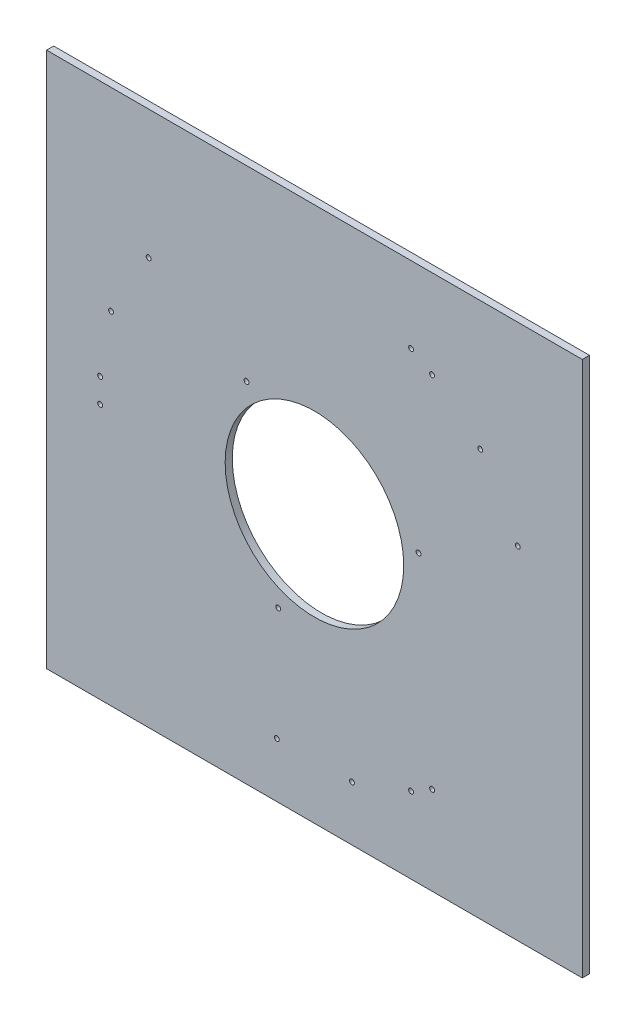
from build123d import *

# Parameters (mm, degrees)
SCHIZZO1_W                   = 375
SCHIZZO1_H                   = 375
ESTRUSIONE_ESTRUSIONE1_DEPTH = 5
TAGLIO_ESTRUSIONE1_REACH     = 267.212
SCHIZZO2_R                   = 62.5
FORO_PER_VITE_M3_4_D         = 3.4
RIPETIZIONECIRCOLARE1_COUNT  = 3
FORO_PER_VITE_M3_2_D         = 3.4
RIPETIZIONECIRCOLARE3_COUNT  = 3
FORO_PER_VITE_M3_5_D         = 3.4
RIPETIZIONECIRCOLARE4_COUNT  = 3


with BuildPart() as part:
    # Schizzo1 → Estrusione-Estrusione1 (new body)
    with BuildSketch(Plane.XY):
        Rectangle(SCHIZZO1_W, SCHIZZO1_H)
    extrude(amount=ESTRUSIONE_ESTRUSIONE1_DEPTH)

    # Schizzo2 → Taglio-Estrusione1 (cut, up to next)
    with BuildSketch(Plane.XY.offset(5), mode=Mode.PRIVATE) as taglio_estrusione1_sk1:
        Circle(SCHIZZO2_R)
    taglio_estrusione1_tool1 = extrude(taglio_estrusione1_sk1.sketch, amount=-TAGLIO_ESTRUSIONE1_REACH, mode=Mode.PRIVATE) & part.part
    add(taglio_estrusione1_tool1.solids().sort_by_distance((0, 0, 5))[0], mode=Mode.SUBTRACT)

    # Foro per Vite M3-4 (through all)
    with Locations(Plane.XY.offset(5)):
        with Locations((-26.307698917, -149.198374581), (26.307698917, -149.198374581)):
            foro_per_vite_m3_4 = Hole(FORO_PER_VITE_M3_4_D / 2)

    # RipetizioneCircolare1: Foro per Vite M3-4 ×3 about axis
    ripetizionecircolare1_axis = Axis((0, 0, 0), (0, 0, 1))
    for i in range(1, RIPETIZIONECIRCOLARE1_COUNT):
        add(foro_per_vite_m3_4.rotate(ripetizionecircolare1_axis, i * 360 / RIPETIZIONECIRCOLARE1_COUNT), mode=Mode.SUBTRACT)

    # Foro per Vite M3-2 (through all)
    with Locations(Plane.XY.offset(5)):
        with Locations((-25.309490606, -69.537253938)):
            foro_per_vite_m3_2 = Hole(FORO_PER_VITE_M3_2_D / 2)

    # RipetizioneCircolare3: Foro per Vite M3-2 ×3 about axis
    ripetizionecircolare3_axis = Axis((0, 0, 0), (0, 0, 1))
    for i in range(1, RIPETIZIONECIRCOLARE3_COUNT):
        add(foro_per_vite_m3_2.rotate(ripetizionecircolare3_axis, i * 360 / RIPETIZIONECIRCOLARE3_COUNT), mode=Mode.SUBTRACT)

    # Foro per Vite M3-5 (through all)
    with Locations(Plane.XY.offset(5)):
        with Locations((67.638784068, 134.153810568), (82.361215932, 125.653810568)):
            foro_per_vite_m3_5 = Hole(FORO_PER_VITE_M3_5_D / 2)

    # RipetizioneCircolare4: Foro per Vite M3-5 ×3 about axis
    ripetizionecircolare4_axis = Axis((0, 0, 0), (0, 0, 1))
    for i in range(1, RIPETIZIONECIRCOLARE4_COUNT):
        add(foro_per_vite_m3_5.rotate(ripetizionecircolare4_axis, i * 360 / RIPETIZIONECIRCOLARE4_COUNT), mode=Mode.SUBTRACT)


solid = part.part
